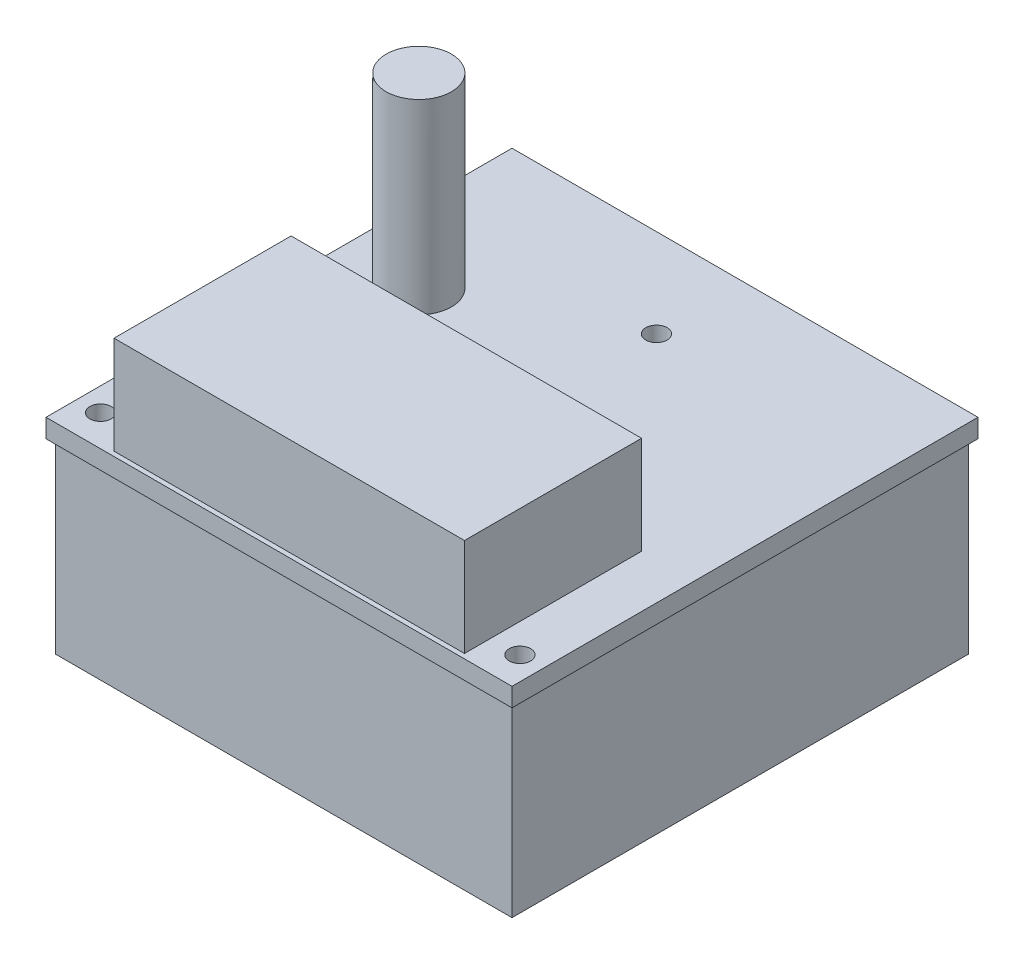
from build123d import *

# Parameters (mm, degrees)
SKETCH1_W           = 50
SKETCH1_H           = 50
SKETCH1_R           = 1.15
BOSS_EXTRUDE1_DEPTH = 2
SKETCH2_W           = 37.6
SKETCH2_H           = 19
BOSS_EXTRUDE2_DEPTH = 10.5
SKETCH3_R           = 3.5
BOSS_EXTRUDE3_DEPTH = 20
SKETCH4_W           = 49
SKETCH4_H           = 49
BOSS_EXTRUDE4_DEPTH = 20


with BuildPart() as part:
    # Sketch1 → Boss-Extrude1 (new body)
    with BuildSketch(Plane(origin=(0, 0, 0), x_dir=(1, 0, 0), z_dir=(0, 1, 0))):
        with Locations((25, 25)):
            Rectangle(SKETCH1_W, SKETCH1_H)
        with Locations(Location((2.5, 3.35, 0), (0, 0, 270))):
            Circle(SKETCH1_R, mode=Mode.SUBTRACT)
        with Locations(Location((47.5, 3.35, 0), (0, 0, 270))):
            Circle(SKETCH1_R, mode=Mode.SUBTRACT)
        with Locations(Location((25, 40.5, 0), (0, 0, 270))):
            Circle(SKETCH1_R, mode=Mode.SUBTRACT)
    extrude(amount=BOSS_EXTRUDE1_DEPTH)

    # Sketch2 → Boss-Extrude2 (add)
    with BuildSketch(Plane(origin=(0, 2, 0), x_dir=(1, 0, 0), z_dir=(0, 1, 0))):
        with Locations((25.6, 10)):
            Rectangle(SKETCH2_W, SKETCH2_H)
    extrude(amount=BOSS_EXTRUDE2_DEPTH)

    # Sketch3 → Boss-Extrude3 (add)
    with BuildSketch(Plane(origin=(0, 2, 0), x_dir=(1, 0, 0), z_dir=(0, 1, 0))):
        with Locations(Location((8, 32, 0), (0, 0, 90))):
            Circle(SKETCH3_R)
    extrude(amount=BOSS_EXTRUDE3_DEPTH)

    # Sketch4 → Boss-Extrude4 (add)
    with BuildSketch(Plane.XZ):
        with Locations((25, -25)):
            Rectangle(SKETCH4_W, SKETCH4_H)
    extrude(amount=BOSS_EXTRUDE4_DEPTH)


solid = part.part
